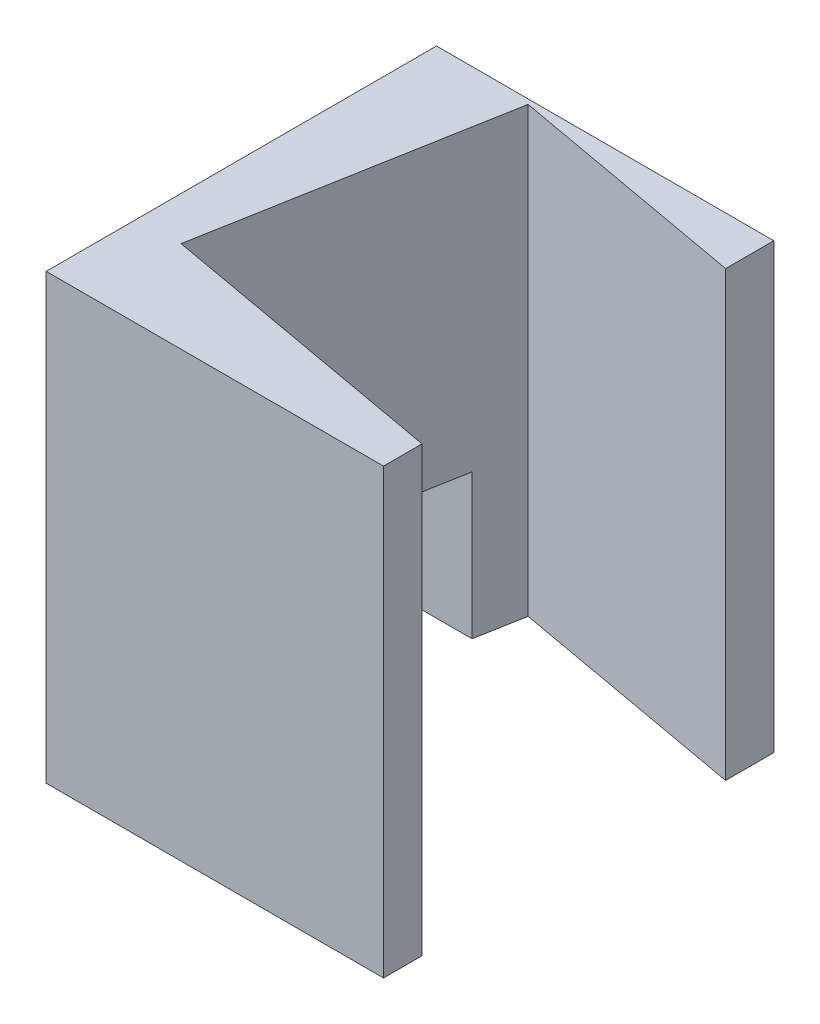
from build123d import *

# Parameters (mm, degrees)
BASE_DEPTH = 18.4


with BuildPart() as part:
    # Croquis17 → BASE (new body)
    with BuildSketch(Plane(origin=(0, 0, 0), x_dir=(-1, 0, 0), z_dir=(0, 1, 0))):
        Polygon((0, 0), (-10, 1.8), (-10, -0.2), (4, -0.2), (4, 15.99927871), (-10, 15.99927871), (-10, 14.39927871), (2.196697179, 12.203873217), align=None)
    extrude(amount=-BASE_DEPTH)

    # Croquis19 → WIRE_WINDOW section 0
    with BuildSketch(Plane(origin=(0, 0, 0), x_dir=(0, 1, 0), z_dir=(0.9841833239736953, 0, 0.17715299831526504))):
        with BuildLine():
            Line((-18.4, 10.4), (-12.4, 10.4))
            Line((-12.4, 10.4), (-12.4, 2))
            Line((-12.4, 2), (-18.4, 2))
            Line((-18.4, 2), (-18.4, 10.4))
        make_face()
    # Croquis20 → WIRE_WINDOW section 1
    with BuildSketch(Plane(origin=(-4, 0, 0), x_dir=(0, -1, 0), z_dir=(-1, 0, 0))):
        with BuildLine():
            Line((18.4, 1.968366648), (12.4, 1.968366648))
            Line((12.4, 1.968366648), (12.4, 10.235506569))
            Line((12.4, 10.235506569), (18.4, 10.235506569))
            Line((18.4, 10.235506569), (18.4, 1.968366648))
        make_face()
    loft(mode=Mode.SUBTRACT)


solid = part.part
